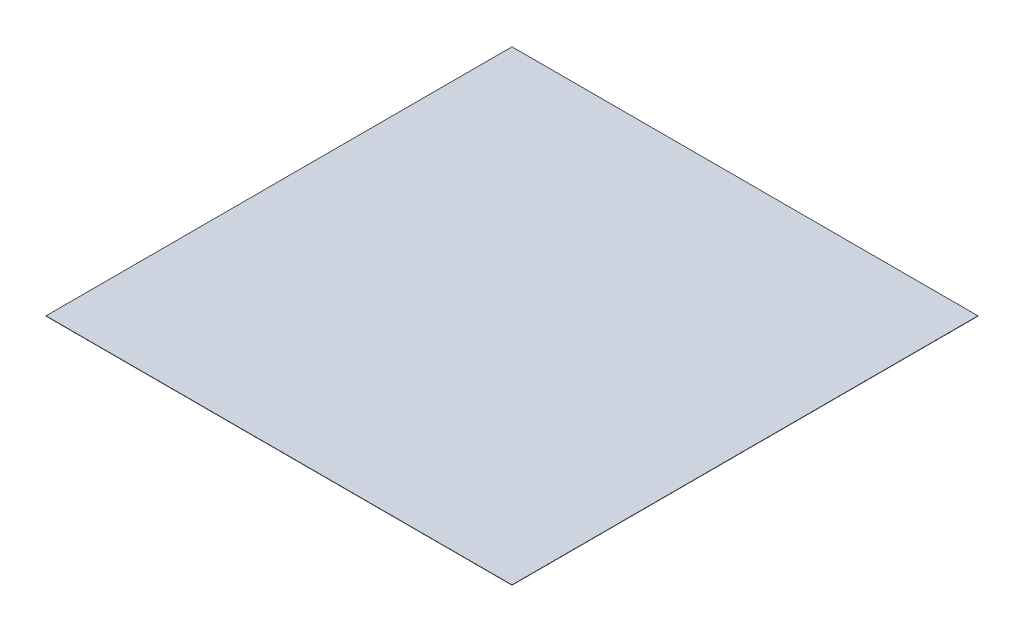
from build123d import *

# Parameters (mm, degrees)
SKETCH1_W           = 170
SKETCH1_H           = 170
BOSS_EXTRUDE1_DEPTH = 0.1


with BuildPart() as part:
    # Sketch1 → Boss-Extrude1 (new body)
    with BuildSketch(Plane(origin=(0, 0, 0), x_dir=(1, 0, 0), z_dir=(0, 1, 0))):
        Rectangle(SKETCH1_W, SKETCH1_H)
    extrude(amount=BOSS_EXTRUDE1_DEPTH)


solid = part.part
